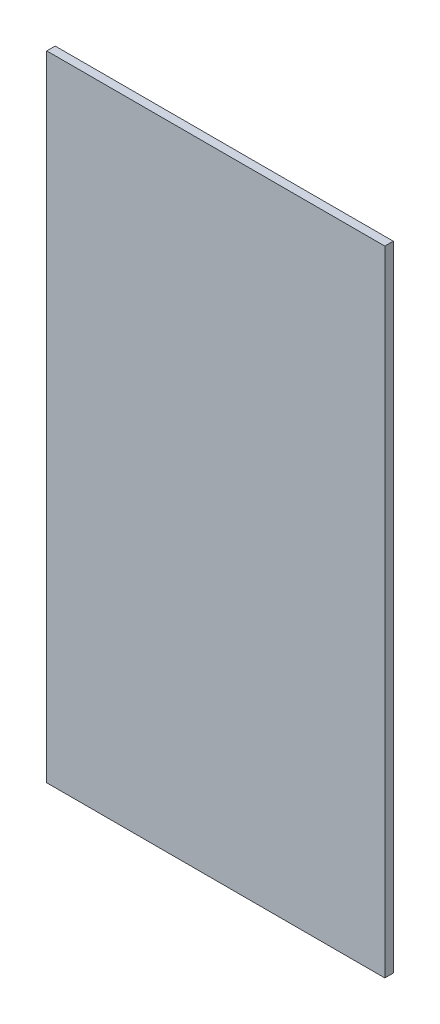
from build123d import *

# Parameters (mm, degrees)
SKETCH1_W           = 400
SKETCH1_H           = 750
BOSS_EXTRUDE1_DEPTH = 10


with BuildPart() as part:
    # Sketch1 → Boss-Extrude1 (new body)
    with BuildSketch(Plane.XY):
        with Locations((200, -375)):
            Rectangle(SKETCH1_W, SKETCH1_H)
    extrude(amount=BOSS_EXTRUDE1_DEPTH)


solid = part.part
